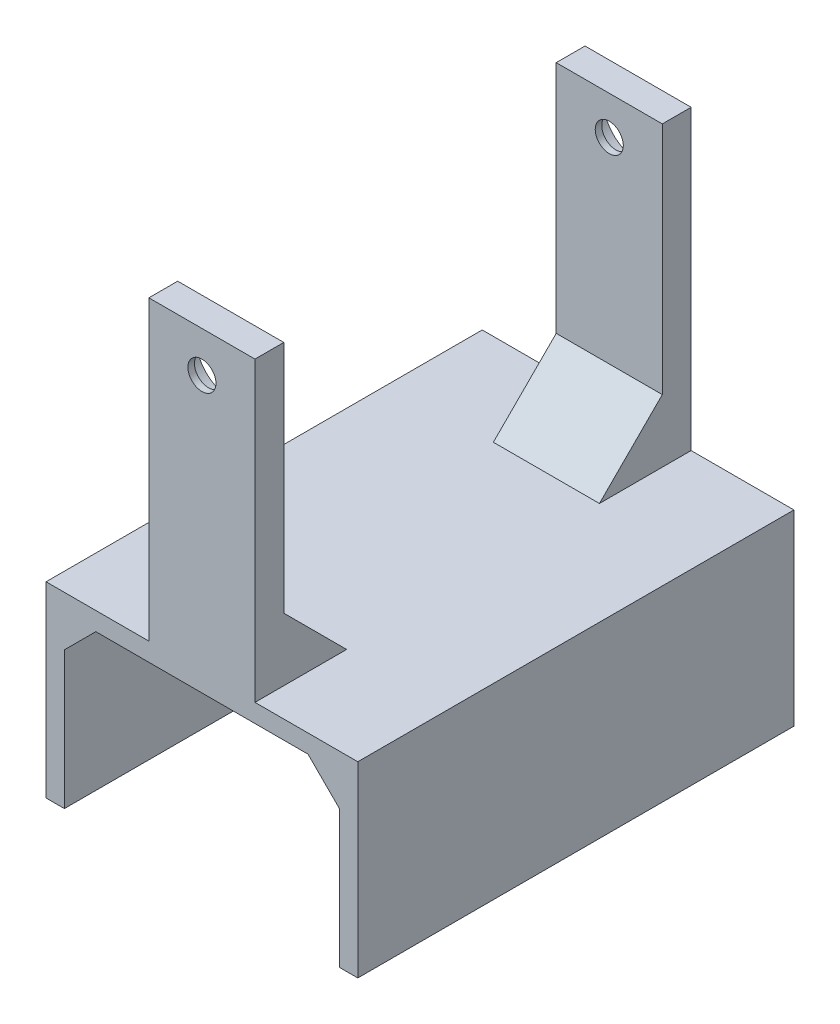
from build123d import *

# Parameters (mm, degrees)
RESSALTO_EXTRUS_O1_DEPTH = 139.86
RESSALTO_EXTRUS_O2_DEPTH = 139.86
ESBO_O3_W                = 34.02
ESBO_O3_H                = 95.34
RESSALTO_EXTRUS_O3_DEPTH = 9.24
ESBO_O4_R                = 4.5
CORTE_EXTRUS_O1_DEPTH    = 9.24
RESSALTO_EXTRUS_O4_DEPTH = 34.02
ESBO_O7_W                = 34.02
ESBO_O7_H                = 95.34
RESSALTO_EXTRUS_O5_DEPTH = 9.24
ESBO_O8_R                = 4.5
CORTE_EXTRUS_O3_DEPTH    = 9.24
ESBO_O9_R                = 11.13
CORTE_EXTRUS_O4_DEPTH    = 7.14
RESSALTO_EXTRUS_O6_DEPTH = 34.02
ESBO_O12_R               = 11.13
CORTE_EXTRUS_O5_DEPTH    = 7.14


with BuildPart() as part:
    # Esboço1 → Ressalto-extrusão1 (new body)
    with BuildSketch(Plane.XY):
        Polygon((44.1, -30.03), (49.98, -30.03), (49.98, 30.03), (-49.98, 30.03), (-49.98, -30.03), (-44.1, -30.03), (-44.1, 24.15), (44.1, 24.15), align=None)
    extrude(amount=RESSALTO_EXTRUS_O1_DEPTH)

    # Esboço2 → Ressalto-extrusão2 (add)
    with BuildSketch(Plane.XY.offset(139.86)):
        Polygon((-44.1, 24.15), (-44.1, 14.07), (-34.02, 24.15), align=None)
        Polygon((44.1, 24.15), (44.1, 14.07), (34.02, 24.15), align=None)
    extrude(amount=-RESSALTO_EXTRUS_O2_DEPTH)

    # Esboço3 → Ressalto-extrusão3 (add)
    with BuildSketch(Plane.XY.offset(139.86)):
        with Locations((0, 77.7)):
            Rectangle(ESBO_O3_W, ESBO_O3_H)
    extrude(amount=-RESSALTO_EXTRUS_O3_DEPTH)

    # Esboço4 → Corte-extrusão1 (cut)
    with BuildSketch(Plane.XY.offset(139.86)):
        with Locations((0, 112.35)):
            Circle(ESBO_O4_R)
    extrude(amount=-CORTE_EXTRUS_O1_DEPTH, mode=Mode.SUBTRACT)

    # Esboço6 → Ressalto-extrusão4 (add)
    with BuildSketch(Plane(origin=(17.01, 0, 0), x_dir=(0, 0, -1), z_dir=(1, 0, 0))):
        Polygon((-130.62, 50.19), (-130.62, 30.03), (-110.46, 30.03), align=None)
    extrude(amount=-RESSALTO_EXTRUS_O4_DEPTH)

    # Esboço7 → Ressalto-extrusão5 (add)
    with BuildSketch(Plane(origin=(0, 0, 0), x_dir=(-1, 0, 0), z_dir=(0, 0, -1))):
        with Locations((0, 77.7)):
            Rectangle(ESBO_O7_W, ESBO_O7_H)
    extrude(amount=-RESSALTO_EXTRUS_O5_DEPTH)

    # Esboço8 → Corte-extrusão3 (cut)
    with BuildSketch(Plane(origin=(0, 0, 0), x_dir=(-1, 0, 0), z_dir=(0, 0, -1))):
        with Locations((0, 113.108647766)):
            Circle(ESBO_O8_R)
    extrude(amount=-CORTE_EXTRUS_O3_DEPTH, mode=Mode.SUBTRACT)

    # Esboço9 → Corte-extrusão4 (cut)
    with BuildSketch(Plane(origin=(0, 0, 0), x_dir=(-1, 0, 0), z_dir=(0, 0, -1))):
        with Locations((0, 113.108647766)):
            Circle(ESBO_O9_R)
    extrude(amount=-CORTE_EXTRUS_O4_DEPTH, mode=Mode.SUBTRACT)

    # Esboço10 → Ressalto-extrusão6 (add)
    with BuildSketch(Plane(origin=(17.01, 0, 0), x_dir=(0, 0, -1), z_dir=(1, 0, 0))):
        Polygon((-9.24, 30.03), (-9.24, 50.19), (-29.4, 30.03), align=None)
    extrude(amount=-RESSALTO_EXTRUS_O6_DEPTH)

    # Esboço12 → Corte-extrusão5 (cut)
    with BuildSketch(Plane(origin=(0, 0, 130.62), x_dir=(-1, 0, 0), z_dir=(0, 0, -1))):
        with Locations((0, 112.35)):
            Circle(ESBO_O12_R)
    extrude(amount=-CORTE_EXTRUS_O5_DEPTH, mode=Mode.SUBTRACT)


solid = part.part
